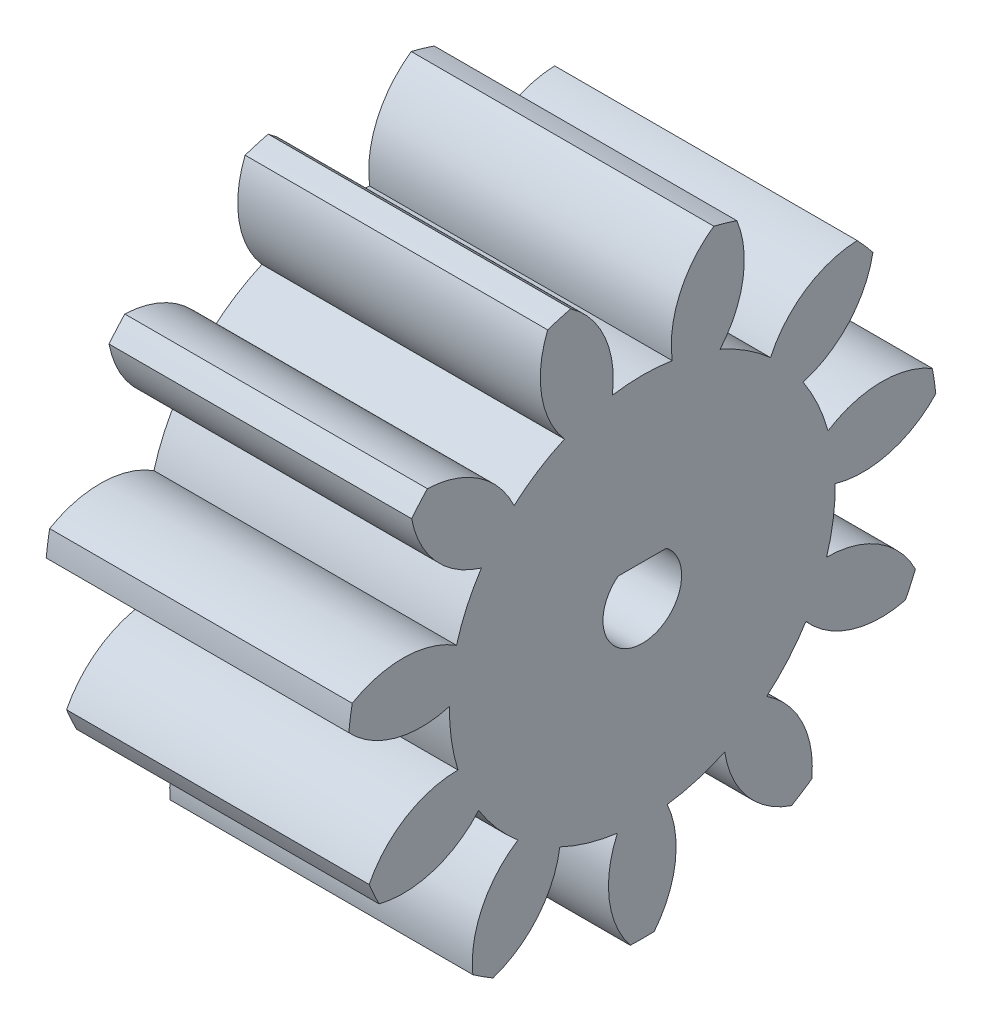
from build123d import *

# Parameters (mm, degrees)
BASPROSKE_W         = 20
BASPROSKE_H         = 19.5
TOOTHCUT_DEPTH      = 35.066112194
TEETHCUTS_COUNT     = 11
BORSKE_R            = 2.5
BORE_DEPTH          = 50.0000508
SKETCH1_R           = 2.6
CUT_EXTRUDE1_DEPTH  = 35.008132728
BOSS_EXTRUDE1_DEPTH = 20


with BuildPart() as part:
    # BasProSke → Base-Revolve (revolve)
    with BuildSketch(Plane(origin=(0, 0, 0), x_dir=(1, 0, 0), z_dir=(0, 1, 0)), mode=Mode.PRIVATE) as base_revolve_sk:
        with Locations((10, 9.75)):
            Rectangle(BASPROSKE_W, BASPROSKE_H)
    revolve(base_revolve_sk.sketch.rotate(Axis((-10, 0, 0), (1, 0, 0)), 180), axis=Axis((-10, 0, 0), (1, 0, 0)))

    # TooCutSke → ToothCut (cut, through all)
    with BuildSketch(Plane(origin=(0, 0, 0), x_dir=(0, 0, -1), z_dir=(1, 0, 0))):
        with BuildLine():
            ThreePointArc((1.981256207, 12.594110721), (0, 12.749), (-1.981256207, 12.594110721))
            ThreePointArc((-1.981256207, 12.594110721), (-2.46948003, 16.158725125), (-4.75478191, 18.937615852))
            ThreePointArc((-4.75478191, 18.937615852), (0, 19.5254), (4.75478191, 18.937615852))
            ThreePointArc((4.75478191, 18.937615852), (2.46948003, 16.158725125), (1.981256207, 12.594110721))
        make_face()
    toothcut = extrude(amount=TOOTHCUT_DEPTH, mode=Mode.SUBTRACT)

    # TeethCuts: ToothCut ×11 about axis
    teethcuts_axis = Axis((0, 0, 0), (1, 0, 0))
    for i in range(1, TEETHCUTS_COUNT):
        add(toothcut.rotate(teethcuts_axis, i * 360 / TEETHCUTS_COUNT), mode=Mode.SUBTRACT)

    # BorSke → Bore (cut, symmetric)
    with BuildSketch(Plane(origin=(0, 0, 0), x_dir=(0, 0, -1), z_dir=(1, 0, 0))):
        with Locations(Location((0, 0, 0), (0, 0, 180))):
            Circle(BORSKE_R)
    extrude(amount=BORE_DEPTH, both=True, mode=Mode.SUBTRACT)

    # Sketch1 → Cut-Extrude1 (cut, through all)
    with BuildSketch(Plane(origin=(20, 0, 0), x_dir=(0, 0, -1), z_dir=(1, 0, 0))):
        Circle(SKETCH1_R)
    extrude(amount=-CUT_EXTRUDE1_DEPTH, mode=Mode.SUBTRACT)

    # Sketch2 → Boss-Extrude1 (add, through all)
    with BuildSketch(Plane(origin=(20, 0, 0), x_dir=(0, 0, -1), z_dir=(1, 0, 0))):
        with BuildLine():
            Line((-1.600307301, 2.0491502), (1.599692663, 2.04963006))
            ThreePointArc((1.599692663, 2.04963006), (-0.000389886, 2.599999971), (-1.600307301, 2.0491502))
        make_face()
    extrude(amount=-BOSS_EXTRUDE1_DEPTH)


solid = part.part
